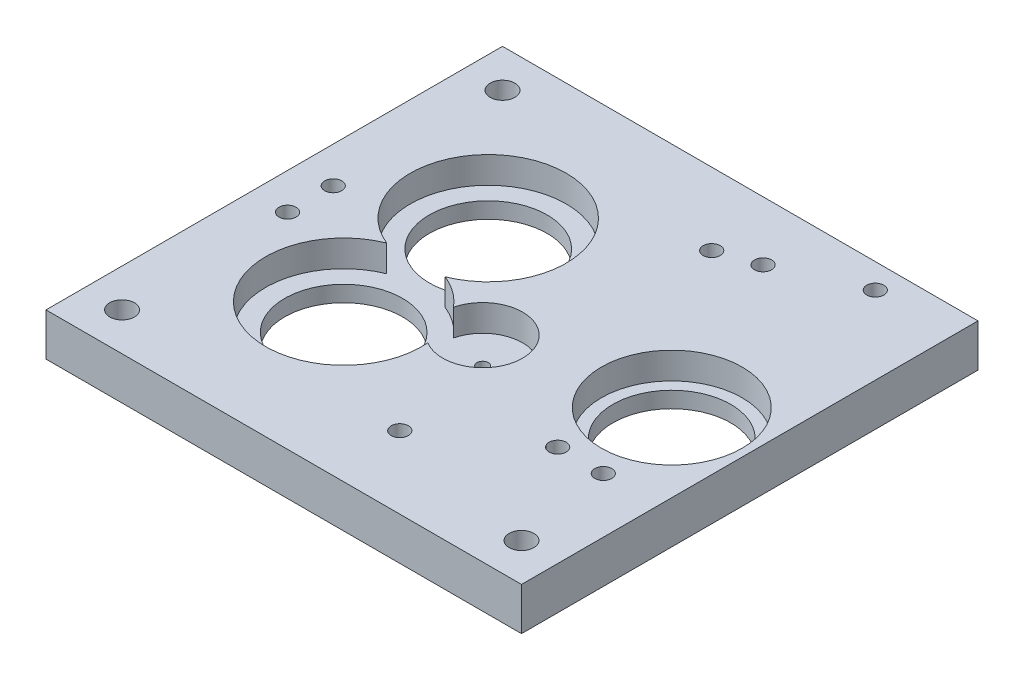
from build123d import *

# Parameters (mm, degrees)
SKETCH1_W                        = 125
SKETCH1_H                        = 120
TEST_BASE_POSTION_DEPTH          = 11.215
SKETCH8_R                        = 20.5
FINGER_GEARS_DEPTH               = 7
SKETCH9_R                        = 10.5
INTERMEDIATE_GEAR_DEPTH          = 7
SKETCH11_R                       = 18.5
XL320_FINGER_KNUCKLE_MOUNT_DEPTH = 7
SKETCH10_R                       = 15.5
CONNECT_FINGER_HOLES_DEPTH       = 88.361468766
THUMB_MOUNT_HOLES_R              = 2.25
THUMB_MOUNT_HOLES_M4_DEPTH       = 88.361468766
SKETCH16_R                       = 2.25
FINGERS_MOUNT_HOLES_M4_DEPTH     = 88.361468766
SKETCH17_R                       = 3.25
CONNECT_HOLES_M6_DEPTH           = 88.361468766
NUTS_M4_DEPTH                    = 4
NUTS_M6_DEPTH                    = 6
SKETCH21_R                       = 1.5
FIX_GEAR_ROD_HOLE_DEPTH          = 2.5


with BuildPart() as part:
    # Sketch1 → Test_Base_Postion (new body)
    with BuildSketch(Plane(origin=(0, 0, 0), x_dir=(1, 0, 0), z_dir=(0, 1, 0))):
        Rectangle(SKETCH1_W, SKETCH1_H)
    extrude(amount=TEST_BASE_POSTION_DEPTH)

    # Sketch8 → Finger_Gears (cut)
    with BuildSketch(Plane(origin=(0, 11.215, 0), x_dir=(1, 0, 0), z_dir=(0, 1, 0))):
        with Locations((-25.25, -19)):
            Circle(SKETCH8_R)
        with Locations((-25.25, 19)):
            Circle(SKETCH8_R)
    extrude(amount=-FINGER_GEARS_DEPTH, mode=Mode.SUBTRACT)

    # Sketch9 → Intermediate_Gear (cut)
    with BuildSketch(Plane(origin=(0, 11.215, 0), x_dir=(1, 0, 0), z_dir=(0, 1, 0))):
        with Locations((0.646123438, -8.351488795)):
            Circle(SKETCH9_R)
    extrude(amount=-INTERMEDIATE_GEAR_DEPTH, mode=Mode.SUBTRACT)

    # Sketch11 → XL320_Finger_Knuckle_Mount (cut)
    with BuildSketch(Plane(origin=(0, 11.215, 0), x_dir=(1, 0, 0), z_dir=(0, 1, 0))):
        with Locations(Location((42, 0, 0), (0, 0, 270))):
            Circle(SKETCH11_R)
    extrude(amount=-XL320_FINGER_KNUCKLE_MOUNT_DEPTH, mode=Mode.SUBTRACT)

    # Sketch10 → Connect_Finger_Holes (cut, through all)
    with BuildSketch(Plane(origin=(0, 11.215, 0), x_dir=(1, 0, 0), z_dir=(0, 1, 0))):
        with Locations(Location((-25.25, 19, 0), (0, 0, 270))):
            Circle(SKETCH10_R)
        with Locations(Location((-25.25, -19, 0), (0, 0, 270))):
            Circle(SKETCH10_R)
        with Locations(Location((42, 0, 0), (0, 0, 270))):
            Circle(SKETCH10_R)
    extrude(amount=-CONNECT_FINGER_HOLES_DEPTH, mode=Mode.SUBTRACT)

    # Thumb_Mount_Holes → Thumb_Mount_Holes_(M4) (cut, through all)
    with BuildSketch(Plane(origin=(0, 11.215, 0), x_dir=(1, 0, 0), z_dir=(0, 1, 0))):
        with Locations(Location((21.5, 44.5, 0), (0, 0, 270))):
            Circle(THUMB_MOUNT_HOLES_R)
        with Locations(Location((42, 53.5, 0), (0, 0, 270))):
            Circle(THUMB_MOUNT_HOLES_R)
        with Locations(Location((48, -24, 0), (0, 0, 270))):
            Circle(THUMB_MOUNT_HOLES_R)
        with Locations(Location((36, -24, 0), (0, 0, 270))):
            Circle(THUMB_MOUNT_HOLES_R)
    extrude(amount=-THUMB_MOUNT_HOLES_M4_DEPTH, mode=Mode.SUBTRACT)

    # Sketch16 → Fingers_Mount_Holes_(M4) (cut, through all)
    with BuildSketch(Plane(origin=(0, 11.215, 0), x_dir=(1, 0, 0), z_dir=(0, 1, 0))):
        with Locations(Location((11.5, 41, 0), (0, 0, 270))):
            Circle(SKETCH16_R)
        with Locations(Location((11.5, -41, 0), (0, 0, 270))):
            Circle(SKETCH16_R)
        with Locations(Location((-53, 6, 0), (0, 0, 270))):
            Circle(SKETCH16_R)
        with Locations(Location((-53, -6, 0), (0, 0, 270))):
            Circle(SKETCH16_R)
    extrude(amount=-FINGERS_MOUNT_HOLES_M4_DEPTH, mode=Mode.SUBTRACT)

    # Sketch17 → Connect_Holes_(M6) (cut, through all)
    with BuildSketch(Plane(origin=(0, 11.215, 0), x_dir=(1, 0, 0), z_dir=(0, 1, 0))):
        with Locations(Location((-52.5, 50, 0), (0, 0, 270))):
            Circle(SKETCH17_R)
        with Locations(Location((-52.5, -50, 0), (0, 0, 270))):
            Circle(SKETCH17_R)
        with Locations(Location((52.5, -50, 0), (0, 0, 270))):
            Circle(SKETCH17_R)
    extrude(amount=-CONNECT_HOLES_M6_DEPTH, mode=Mode.SUBTRACT)

    # Sketch18 → Nuts_(M4) (cut)
    with BuildSketch(Plane.XZ):
        Polygon((11.5, 47.639528096), (5.75, 44.319764048), (5.75, 37.680235952), (11.5, 34.360471904), (17.25, 37.680235952), (17.25, 44.319764048), align=None)
        Polygon((11.5, -34.360471904), (5.75, -37.680235952), (5.75, -44.319764048), (11.5, -47.639528096), (17.25, -44.319764048), (17.25, -37.680235952), align=None)
        Polygon((15.75, -41.180235952), (15.75, -47.819764048), (21.5, -51.139528096), (27.25, -47.819764048), (27.25, -41.180235952), (21.5, -37.860471904), align=None)
        Polygon((42, -60.139528096), (47.75, -56.819764048), (47.75, -50.180235952), (42, -46.860471904), (36.25, -50.180235952), (36.25, -56.819764048), align=None)
    extrude(amount=-NUTS_M4_DEPTH, mode=Mode.SUBTRACT)

    # Sketch19 → Nuts_(M6) (cut)
    with BuildSketch(Plane.XZ):
        Polygon((-52.5, 58.371578903), (-59.75, 54.185789452), (-59.75, 45.814210548), (-52.5, 41.628421097), (-45.25, 45.814210548), (-45.25, 54.185789452), align=None)
        Polygon((52.5, 58.371578903), (45.25, 54.185789452), (45.25, 45.814210548), (52.5, 41.628421097), (59.75, 45.814210548), (59.75, 54.185789452), align=None)
        Polygon((-52.5, -41.628421097), (-59.75, -45.814210548), (-59.75, -54.185789452), (-52.5, -58.371578903), (-45.25, -54.185789452), (-45.25, -45.814210548), align=None)
    extrude(amount=-NUTS_M6_DEPTH, mode=Mode.SUBTRACT)

    # Sketch21 → Fix_Gear_Rod_Hole (cut)
    with BuildSketch(Plane(origin=(0, 4.215, 0), x_dir=(1, 0, 0), z_dir=(0, 1, 0))):
        with Locations(Location((0.646123438, -8.351488795, 0), (0, 0, 270))):
            Circle(SKETCH21_R)
    extrude(amount=-FIX_GEAR_ROD_HOLE_DEPTH, mode=Mode.SUBTRACT)


solid = part.part
